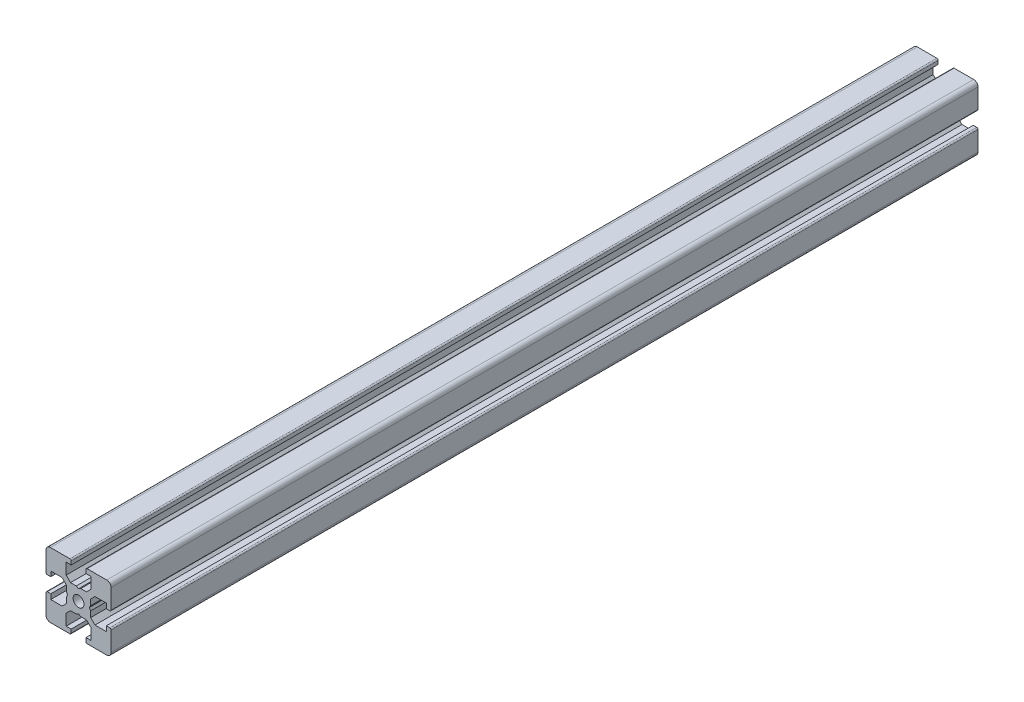
from build123d import *

# Parameters (mm, degrees)
SKETCH1_R           = 1.25
BOSS_EXTRUDE1_DEPTH = 200


with BuildPart() as part:
    # Sketch1 → Boss-Extrude1 (new body)
    with BuildSketch(Plane.XY.offset(300)):
        with BuildLine():
            Line((-7.5, 6.5), (-7.5, 2))
            ThreePointArc((-7.5, 2), (-7.412132034, 1.787867966), (-7.2, 1.7))
            Line((-7.2, 1.7), (-6.4, 1.7))
            Line((-6.4, 1.7), (-6.4, 2.85))
            Line((-6.4, 2.85), (-3.8, 2.85))
            Line((-3.8, 2.85), (-2.8, 1.85))
            Line((-2.8, 1.85), (-2.8, 0.519615242))
            Line((-2.8, 0.519615242), (-2.5, 0))
            Line((-2.5, 0), (-2.8, -0.519615242))
            Line((-2.8, -0.519615242), (-2.8, -1.85))
            Line((-2.8, -1.85), (-3.8, -2.85))
            Line((-3.8, -2.85), (-6.4, -2.85))
            Line((-6.4, -2.85), (-6.4, -1.7))
            Line((-6.4, -1.7), (-7.2, -1.7))
            ThreePointArc((-7.2, -1.7), (-7.412132034, -1.787867966), (-7.5, -2))
            Line((-7.5, -2), (-7.5, -6.5))
            ThreePointArc((-7.5, -6.5), (-7.207106781, -7.207106781), (-6.5, -7.5))
            Line((-6.5, -7.5), (-2, -7.5))
            ThreePointArc((-2, -7.5), (-1.787867966, -7.412132034), (-1.7, -7.2))
            Line((-1.7, -7.2), (-1.7, -6.4))
            Line((-1.7, -6.4), (-2.85, -6.4))
            Line((-2.85, -6.4), (-2.85, -3.8))
            Line((-2.85, -3.8), (-1.85, -2.8))
            Line((-1.85, -2.8), (-0.519615242, -2.8))
            Line((-0.519615242, -2.8), (0, -2.5))
            Line((0, -2.5), (0.519615242, -2.8))
            Line((0.519615242, -2.8), (1.85, -2.8))
            Line((1.85, -2.8), (2.85, -3.8))
            Line((2.85, -3.8), (2.85, -6.4))
            Line((2.85, -6.4), (1.7, -6.4))
            Line((1.7, -6.4), (1.7, -7.2))
            ThreePointArc((1.7, -7.2), (1.787867966, -7.412132034), (2, -7.5))
            Line((2, -7.5), (6.5, -7.5))
            ThreePointArc((6.5, -7.5), (7.207106781, -7.207106781), (7.5, -6.5))
            Line((7.5, -6.5), (7.5, -2))
            ThreePointArc((7.5, -2), (7.412132034, -1.787867966), (7.2, -1.7))
            Line((7.2, -1.7), (6.4, -1.7))
            Line((6.4, -1.7), (6.4, -2.85))
            Line((6.4, -2.85), (3.8, -2.85))
            Line((3.8, -2.85), (2.8, -1.85))
            Line((2.8, -1.85), (2.8, -0.519615242))
            Line((2.8, -0.519615242), (2.5, 0))
            Line((2.5, 0), (2.8, 0.519615242))
            Line((2.8, 0.519615242), (2.8, 1.85))
            Line((2.8, 1.85), (3.8, 2.85))
            Line((3.8, 2.85), (6.4, 2.85))
            Line((6.4, 2.85), (6.4, 1.7))
            Line((6.4, 1.7), (7.2, 1.7))
            ThreePointArc((7.2, 1.7), (7.412132034, 1.787867966), (7.5, 2))
            Line((7.5, 2), (7.5, 6.5))
            ThreePointArc((7.5, 6.5), (7.207106781, 7.207106781), (6.5, 7.5))
            Line((6.5, 7.5), (2, 7.5))
            ThreePointArc((2, 7.5), (1.787867966, 7.412132034), (1.7, 7.2))
            Line((1.7, 7.2), (1.7, 6.4))
            Line((1.7, 6.4), (2.85, 6.4))
            Line((2.85, 6.4), (2.85, 3.8))
            Line((2.85, 3.8), (1.85, 2.8))
            Line((1.85, 2.8), (0.519615242, 2.8))
            Line((0.519615242, 2.8), (0, 2.5))
            Line((0, 2.5), (-0.519615242, 2.8))
            Line((-0.519615242, 2.8), (-1.85, 2.8))
            Line((-1.85, 2.8), (-2.85, 3.8))
            Line((-2.85, 3.8), (-2.85, 6.4))
            Line((-2.85, 6.4), (-1.7, 6.4))
            Line((-1.7, 6.4), (-1.7, 7.2))
            ThreePointArc((-1.7, 7.2), (-1.787867966, 7.412132034), (-2, 7.5))
            Line((-2, 7.5), (-6.5, 7.5))
            ThreePointArc((-6.5, 7.5), (-7.207106781, 7.207106781), (-7.5, 6.5))
        make_face()
        with Locations(Location((0, 0, 0), (0, 0, 180))):
            Circle(SKETCH1_R, mode=Mode.SUBTRACT)
    extrude(amount=-BOSS_EXTRUDE1_DEPTH)


solid = part.part
